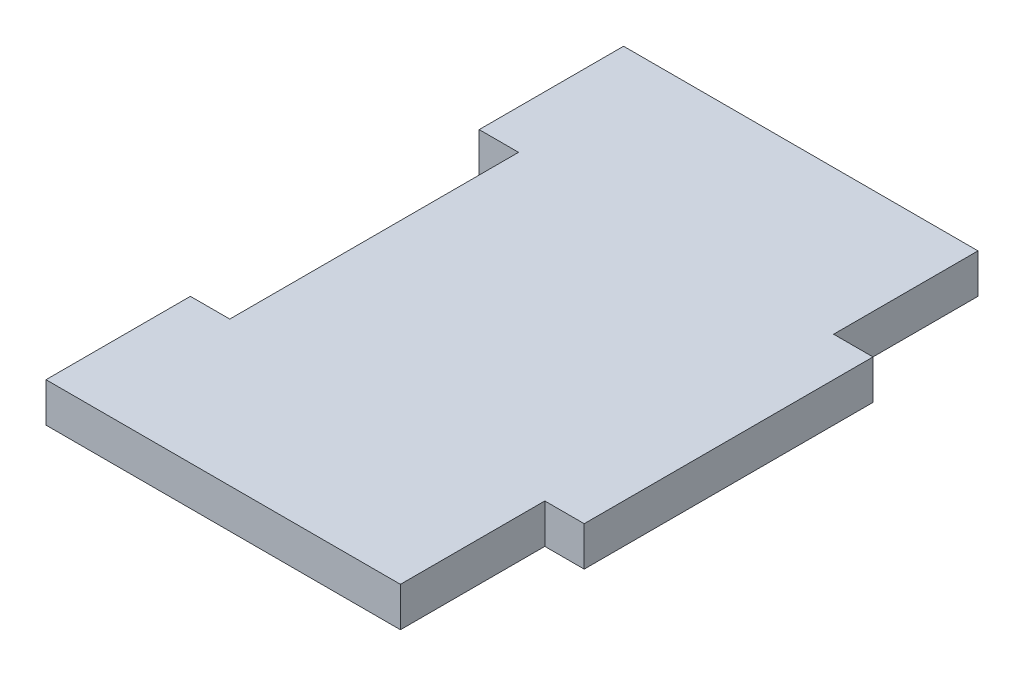
from build123d import *

# Parameters (mm, degrees)
SALIENTE_EXTRUIR1_DEPTH = 3


with BuildPart() as part:
    # Croquis1 → Saliente-Extruir1 (new body)
    with BuildSketch(Plane(origin=(0, 0, 0), x_dir=(1, 0, 0), z_dir=(0, 1, 0))):
        Polygon((0, 33), (0, 44), (27, 44), (27, 33), (30, 33), (30, 11), (27, 11), (27, 0), (0, 0), (0, 11), (3, 11), (3, 22), (3, 33), align=None)
    extrude(amount=SALIENTE_EXTRUIR1_DEPTH)


solid = part.part
